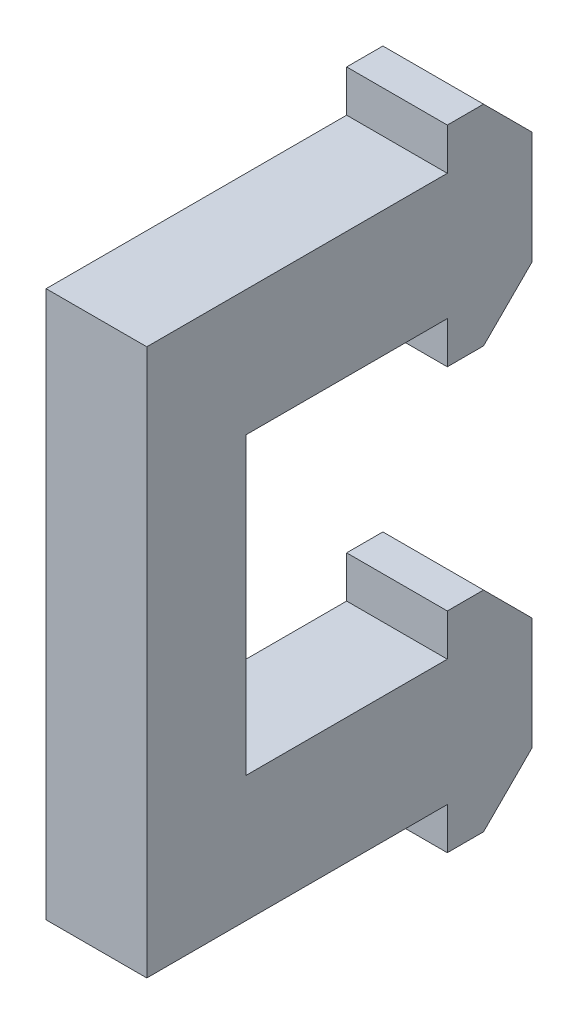
from build123d import *

# Parameters (mm, degrees)
BOSS_EXTRUDE1_DEPTH = 5
SKETCH3_W           = 4.925645198
SKETCH3_H           = 33.799871634
BOSS_EXTRUDE2_DEPTH = 5
SKETCH4_W           = 4.925645198
SKETCH4_H           = 6.649871634
CUT_EXTRUDE1_DEPTH  = 37.492986368


with BuildPart() as part:
    # Sketch2 → Boss-Extrude1 (new body)
    with BuildSketch(Plane(origin=(0, 0, 0), x_dir=(0, 0, -1), z_dir=(1, 0, 0))):
        Polygon((-4.2, 3.125), (-14.2, 3.125), (-14.2, -3.125), (-4.2, -3.125), (-4.2, -5.2), (-2.4, -5.2), (0, -2.8), (0, 2.8), (-2.4, 5.2), (-4.2, 5.2), align=None)
    boss_extrude1 = extrude(amount=BOSS_EXTRUDE1_DEPTH)

    # Sketch3 → Boss-Extrude2 (add)
    with BuildSketch(Plane.ZY):
        with Locations((16.662822599, 13.774935817)):
            Rectangle(SKETCH3_W, SKETCH3_H)
    extrude(amount=-BOSS_EXTRUDE2_DEPTH)

    # Mirror2: Boss-Extrude1 across plane
    add(boss_extrude1.mirror(Plane.ZX.offset(10.45)))

    # Sketch4 → Cut-Extrude1 (cut, through all)
    with BuildSketch(Plane.ZY):
        with Locations((16.662822599, 27.349935817)):
            Rectangle(SKETCH4_W, SKETCH4_H)
    extrude(amount=-CUT_EXTRUDE1_DEPTH, mode=Mode.SUBTRACT)


solid = part.part
